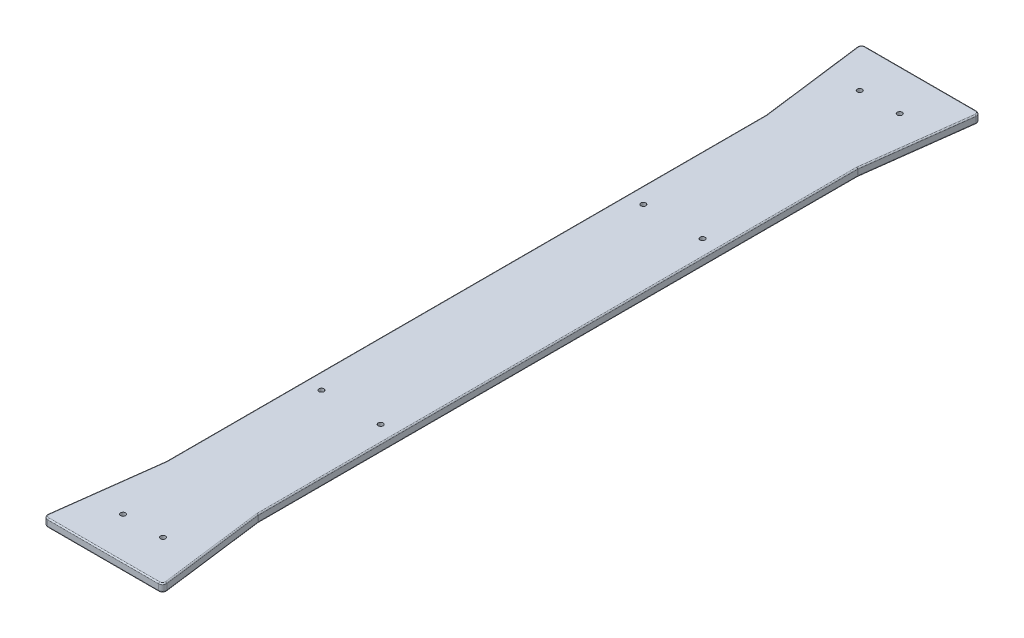
from build123d import *

# Parameters (mm, degrees)
SKETCH1_R           = 1.5875
BOSS_EXTRUDE1_DEPTH = 5.08
FILLET1_R           = 2.54
FILLET2_R           = 0.762
SKETCH2_R           = 1.5875
CUT_EXTRUDE1_DEPTH  = 263.560055455


with BuildPart() as part:
    # Sketch1 → Boss-Extrude1 (new body)
    with BuildSketch(Plane(origin=(0, 0, 0), x_dir=(1, 0, 0), z_dir=(0, 1, 0))):
        Polygon((-29.21, -190.5), (-29.21, 190.5), (-38.1, 259.781963021), (38.1, 259.781963021), (29.21, 190.5), (29.21, -190.5), (38.1, -259.781963021), (-38.1, -259.781963021), align=None)
        with Locations(Location((-18.796, 102.235, 0), (0, 0, 270))):
            Circle(SKETCH1_R, mode=Mode.SUBTRACT)
        with Locations(Location((18.796, 102.235, 0), (0, 0, 90))):
            Circle(SKETCH1_R, mode=Mode.SUBTRACT)
        with Locations(Location((18.796, -102.235, 0), (0, 0, 270))):
            Circle(SKETCH1_R, mode=Mode.SUBTRACT)
        with Locations(Location((-18.796, -102.235, 0), (0, 0, 90))):
            Circle(SKETCH1_R, mode=Mode.SUBTRACT)
    extrude(amount=BOSS_EXTRUDE1_DEPTH)

    # Fillet1
    fillet1_edges = [part.edges().sort_by_distance(p)[0] for p in [
        (29.21, 2.54, -190.5),
        (29.21, 2.54, 190.5),
        (38.1, 2.54, 259.781963021),
        (-38.1, 2.54, 259.781963021),
        (-29.21, 2.54, 190.5),
        (-38.1, 2.54, -259.781963021),
        (38.1, 2.54, -259.781963021),
    ]]
    fillet(fillet1_edges, radius=FILLET1_R)

    # Fillet2
    fillet2_edges = [part.edges().sort_by_distance(p)[0] for p in [
        (-29.21, 0, -0.08114814),
        (-29.21, 5.08, -0.08114814),
        (-33.471297825, 0, -223.709345147),
        (-33.471297825, 5.08, -223.709345147),
        (33.48162577, 0, -223.78983337),
        (29.21, 0, 0),
        (33.48162577, 0, 223.78983337),
        (0, 0, 259.781963021),
        (-33.48162577, 0, 223.78983337),
        (0, 0, -259.781963021),
        (37.120174812, 0, -258.919831799),
        (37.120174812, 0, 258.919831799),
        (-37.120174812, 0, 258.919831799),
        (-37.120174812, 0, -258.919831799),
        (0, 5.08, -259.781963021),
        (33.48162577, 5.08, -223.78983337),
        (-33.48162577, 5.08, 223.78983337),
        (0, 5.08, 259.781963021),
        (33.48162577, 5.08, 223.78983337),
        (29.21, 5.08, 0),
        (37.120174812, 5.08, -258.919831799),
        (37.120174812, 5.08, 258.919831799),
        (-37.120174812, 5.08, 258.919831799),
        (-37.120174812, 5.08, -258.919831799),
        (-29.215169233, 0, 190.499669706),
        (-29.215169233, 5.08, 190.499669706),
        (29.215169233, 0, 190.499669706),
        (29.215169233, 5.08, 190.499669706),
        (29.215169233, 0, -190.499669706),
        (29.215169233, 5.08, -190.499669706),
    ]]
    fillet(fillet2_edges, radius=FILLET2_R)

    # Sketch2 → Cut-Extrude1 (cut, through all)
    with BuildSketch(Plane(origin=(0, 5.08, 0), x_dir=(1, 0, 0), z_dir=(0, 1, 0))):
        with Locations(Location((-12.7, 233.619963021, 0), (0, 0, 270))):
            Circle(SKETCH2_R)
        with Locations(Location((12.7, 233.619963021, 0), (0, 0, 90))):
            Circle(SKETCH2_R)
        with Locations(Location((11.833787679, -233.559959271, 0), (0, 0, 270))):
            Circle(SKETCH2_R)
        with Locations(Location((-13.566037681, -233.46576979, 0), (0, 0, 90))):
            Circle(SKETCH2_R)
    extrude(amount=-CUT_EXTRUDE1_DEPTH, mode=Mode.SUBTRACT)


solid = part.part
